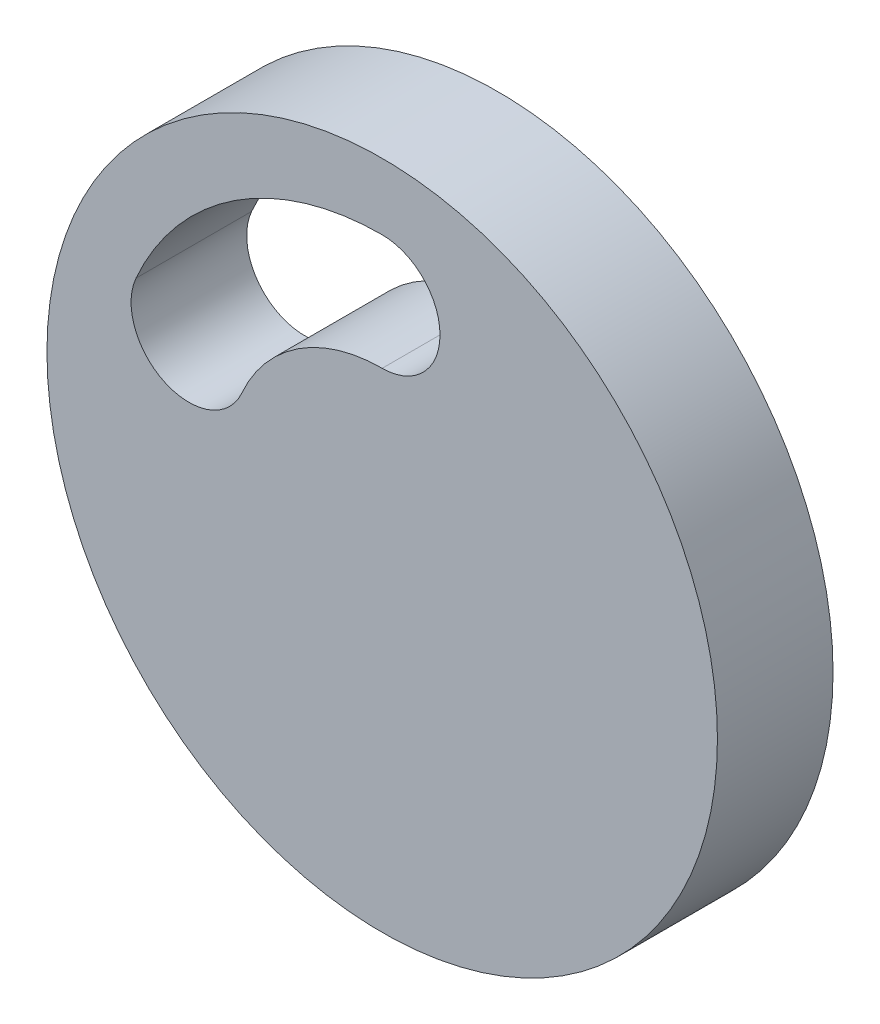
from build123d import *

# Parameters (mm, degrees)
SKETCH_1_R      = 2.899935842
EXTRUDE_1_DEPTH = 1


with BuildPart() as part:
    # 草圖1 → 填料-伸長1 (new body)
    with BuildSketch(Plane.XY):
        Circle(SKETCH_1_R)
        with BuildLine():
            ThreePointArc((0, 2.326630403), (-1.271608832, 1.94838908), (-2.129765657, 0.936646827))
            ThreePointArc((-2.129765657, 0.936646827), (-1.873360766, 0.277665392), (-1.21437933, 0.534070283))
            ThreePointArc((-1.21437933, 0.534070283), (-0.725063566, 1.110959518), (0, 1.326630403))
            ThreePointArc((0, 1.326630403), (0.5, 1.826630403), (0, 2.326630403))
        make_face(mode=Mode.SUBTRACT)
    extrude(amount=EXTRUDE_1_DEPTH)


solid = part.part
